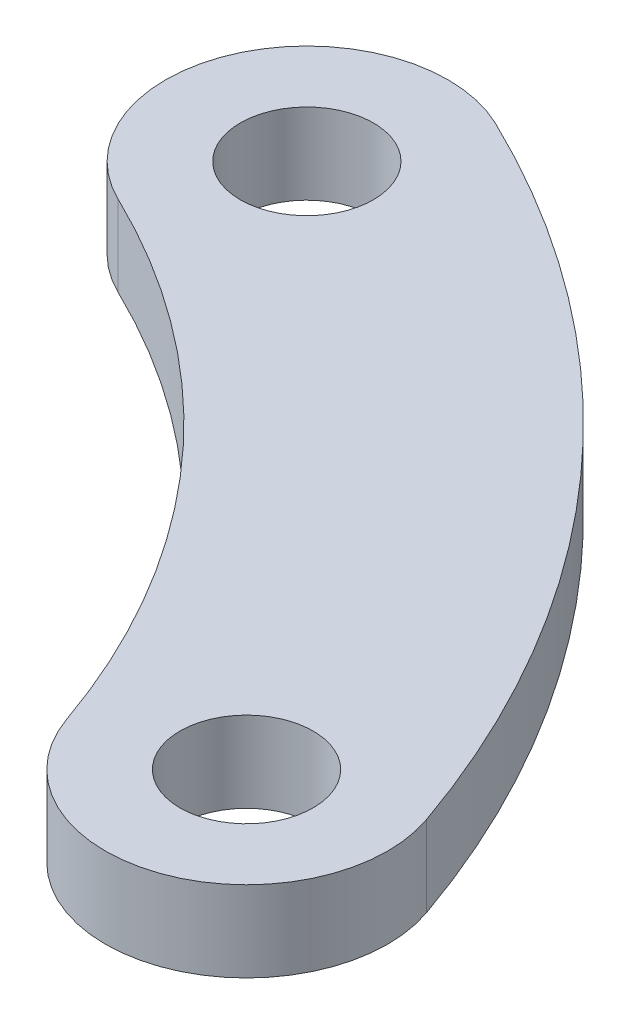
from build123d import *

# Parameters (mm, degrees)
SKETCH1_R           = 1.65
BOSS_EXTRUDE1_DEPTH = 2


with BuildPart() as part:
    # Sketch1 → Boss-Extrude1 (new body)
    with BuildSketch(Plane(origin=(0, 2, 0), x_dir=(1, 0, 0), z_dir=(0, 1, 0))):
        with BuildLine():
            ThreePointArc((26.108282991, 9.103848595), (20.637016257, 18.402066732), (12.023950872, 24.898737025))
            ThreePointArc((12.023950872, 24.898737025), (7.350192911, 23.269017259), (8.979912677, 18.595259297))
            ThreePointArc((8.979912677, 18.595259297), (15.412455179, 13.743315661), (19.498591095, 6.799076799))
            ThreePointArc((19.498591095, 6.799076799), (23.955822941, 4.646616748), (26.108282991, 9.103848595))
        make_face()
        with Locations(Location((10.501931774, 21.746998161, 0), (0, 0, 270))):
            Circle(SKETCH1_R, mode=Mode.SUBTRACT)
        with Locations(Location((22.803437043, 7.951462697, 0), (0, 0, 270))):
            Circle(SKETCH1_R, mode=Mode.SUBTRACT)
    extrude(amount=BOSS_EXTRUDE1_DEPTH)


solid = part.part
